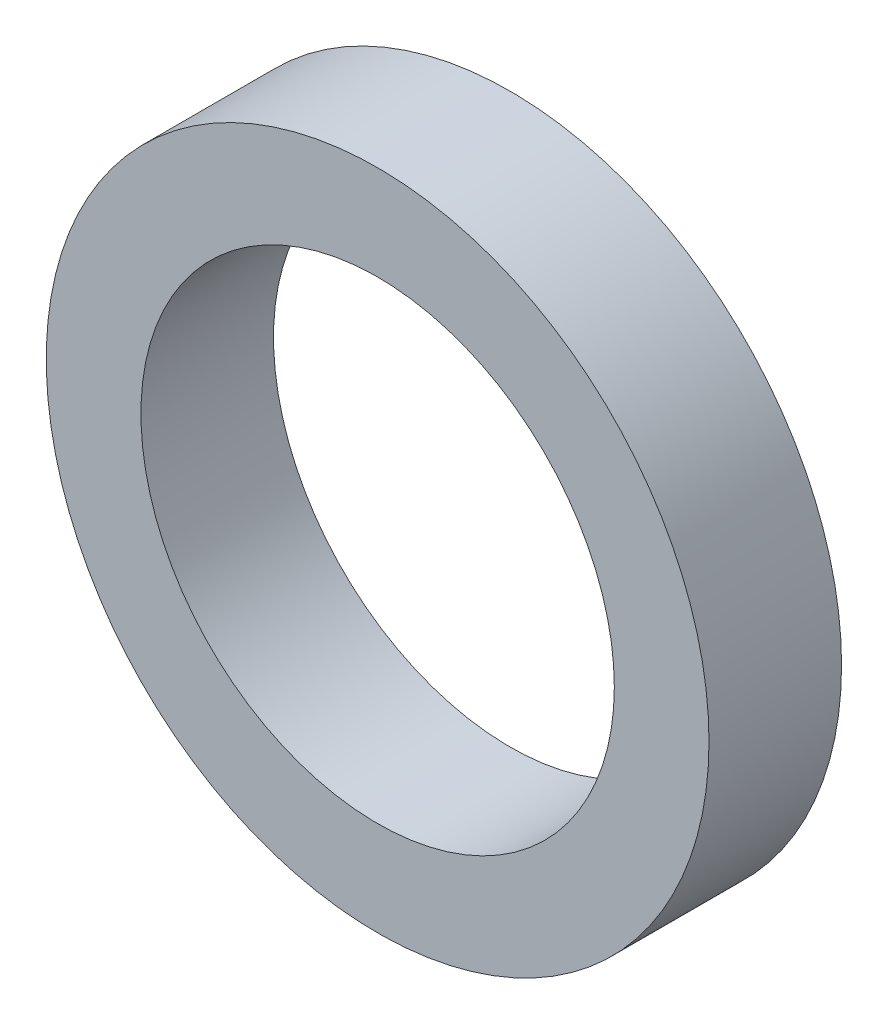
from build123d import *

# Parameters (mm, degrees)
SKETCH1_R           = 35
SKETCH1_R_2         = 25
BOSS_EXTRUDE1_DEPTH = 14


with BuildPart() as part:
    # Sketch1 → Boss-Extrude1 (new body)
    with BuildSketch(Plane.XY):
        Circle(SKETCH1_R)
        Circle(SKETCH1_R_2, mode=Mode.SUBTRACT)
    extrude(amount=BOSS_EXTRUDE1_DEPTH)


solid = part.part
